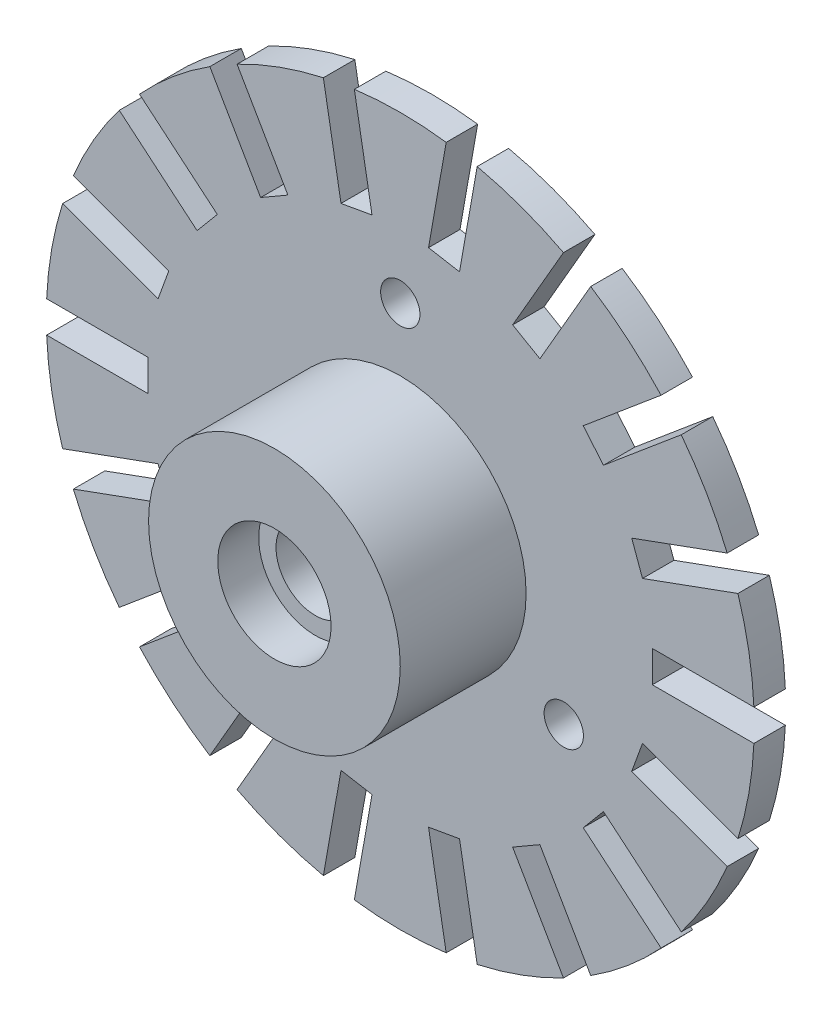
from build123d import *

# Parameters (mm, degrees)
SKETCH1_R           = 22.5
BOSS_EXTRUDE1_DEPTH = 2
SKETCH2_R           = 8
BOSS_EXTRUDE2_DEPTH = 8
SKETCH3_R           = 2.5
CUT_EXTRUDE1_DEPTH  = 34.35416016
SKETCH4_R           = 3.6
CUT_EXTRUDE2_DEPTH  = 2.6
SKETCH5_R           = 1.25
CUT_EXTRUDE3_DEPTH  = 33.810059433
SKETCH7_W           = 7.216965313
SKETCH7_H           = 2
CUT_EXTRUDE4_DEPTH  = 10
CIRPATTERN1_COUNT   = 18


with BuildPart() as part:
    # Sketch1 → Boss-Extrude1 (new body)
    with BuildSketch(Plane.XY):
        Circle(SKETCH1_R)
    extrude(amount=BOSS_EXTRUDE1_DEPTH)

    # Sketch2 → Boss-Extrude2 (add)
    with BuildSketch(Plane.XY.offset(2)):
        Circle(SKETCH2_R)
    extrude(amount=BOSS_EXTRUDE2_DEPTH)

    # Sketch3 → Cut-Extrude1 (cut, through all)
    with BuildSketch(Plane.XY.offset(10)):
        Circle(SKETCH3_R)
    extrude(amount=-CUT_EXTRUDE1_DEPTH, mode=Mode.SUBTRACT)

    # Sketch4 → Cut-Extrude2 (cut)
    with BuildSketch(Plane.XY.offset(10)):
        Circle(SKETCH4_R)
    extrude(amount=-CUT_EXTRUDE2_DEPTH, mode=Mode.SUBTRACT)

    # Sketch5 → Cut-Extrude3 (cut, through all)
    with BuildSketch(Plane.XY.offset(2)):
        with Locations((0, 12)):
            Circle(SKETCH5_R)
        with Locations((-10.392304845, -6)):
            Circle(SKETCH5_R)
        with Locations((10.392304845, -6)):
            Circle(SKETCH5_R)
    extrude(amount=-CUT_EXTRUDE3_DEPTH, mode=Mode.SUBTRACT)

    # Sketch7 → Cut-Extrude4 (cut)
    with BuildSketch(Plane.XY.offset(2)):
        with Locations((19.628882318, 0)):
            Rectangle(SKETCH7_W, SKETCH7_H)
    cut_extrude4 = extrude(amount=-CUT_EXTRUDE4_DEPTH, mode=Mode.SUBTRACT)

    # CirPattern1: Cut-Extrude4 ×18 about axis
    cirpattern1_axis = Axis((0, 0, 0), (0, 0, 1))
    for i in range(1, CIRPATTERN1_COUNT):
        add(cut_extrude4.rotate(cirpattern1_axis, i * 360 / CIRPATTERN1_COUNT), mode=Mode.SUBTRACT)


solid = part.part
